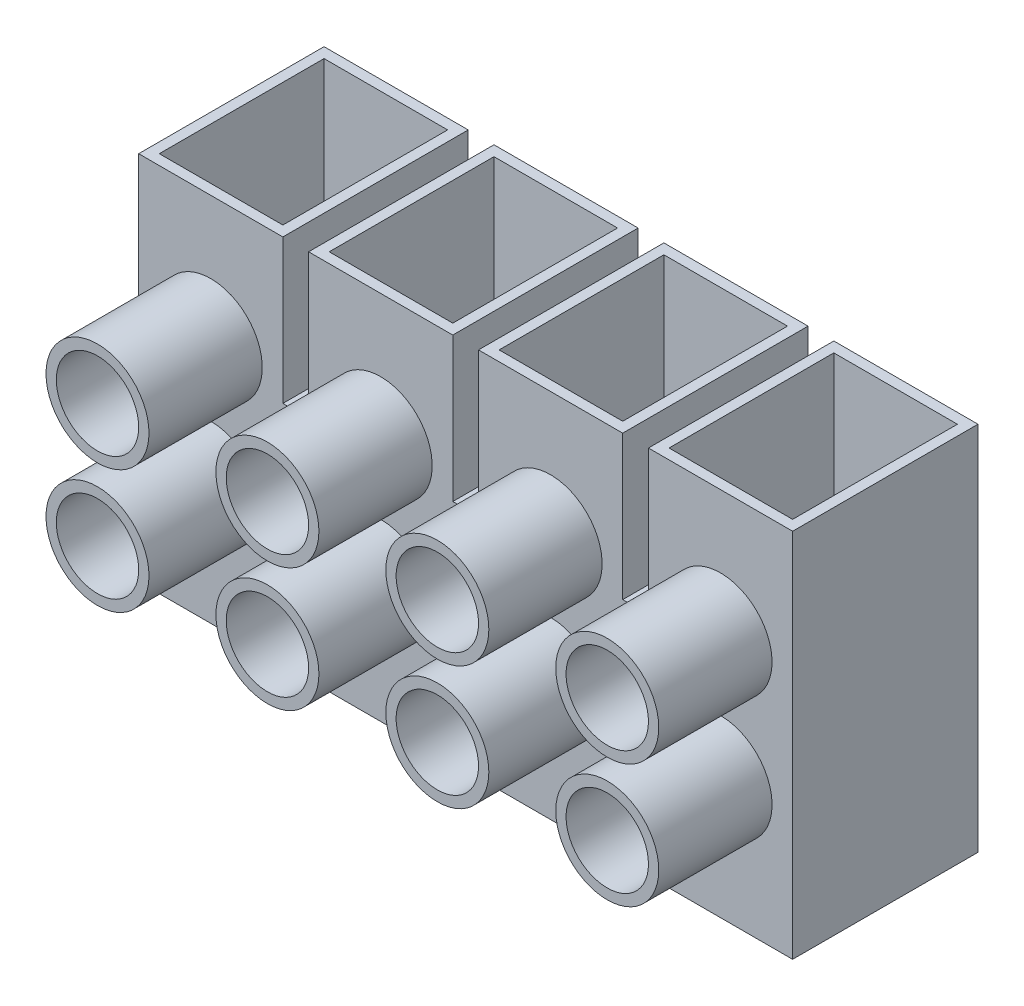
from build123d import *

# Parameters (mm, degrees)
CROQUIS1_W                = 7
CROQUIS1_H                = 18
SALIENTE_EXTRUIR1_DEPTH   = 9
SALIENTE_EXTRUIR1_2_DEPTH = 9
SALIENTE_EXTRUIR1_3_DEPTH = 9
SALIENTE_EXTRUIR1_4_DEPTH = 9
CROQUIS2_W                = 24.75
CROQUIS2_H                = 4
SALIENTE_EXTRUIR2_DEPTH   = 9
CROQUIS3_R                = 2.5
CROQUIS3_R_2              = 2
SALIENTE_EXTRUIR3_DEPTH   = 5.5
CROQUIS4_R                = 1
CORTAR_EXTRUIR1_DEPTH     = 38.59072359
CROQUIS5_W                = 6
CROQUIS5_H                = 8
CORTAR_EXTRUIR2_DEPTH     = 40.272286666


with BuildPart() as part:
    # Croquis1 → Saliente-Extruir1 (new body)
    with BuildSketch(Plane.XY):
        with Locations((11.75, 9)):
            Rectangle(CROQUIS1_W, CROQUIS1_H)
    extrude(amount=SALIENTE_EXTRUIR1_DEPTH)



with BuildPart() as body_2:
    # Croquis1 → Saliente-Extruir1 2 (new body)
    with BuildSketch(Plane.XY):
        with Locations((3.5, 9)):
            Rectangle(CROQUIS1_W, CROQUIS1_H)
    extrude(amount=SALIENTE_EXTRUIR1_2_DEPTH)


with BuildPart() as body_3:
    # Croquis1 → Saliente-Extruir1 3 (new body)
    with BuildSketch(Plane.XY):
        with Locations((20, 9)):
            Rectangle(CROQUIS1_W, CROQUIS1_H)
    extrude(amount=SALIENTE_EXTRUIR1_3_DEPTH)


with BuildPart() as body_4:
    # Croquis1 → Saliente-Extruir1 4 (new body)
    with BuildSketch(Plane.XY):
        with Locations((28.25, 9)):
            Rectangle(CROQUIS1_W, CROQUIS1_H)
    extrude(amount=SALIENTE_EXTRUIR1_4_DEPTH)


with BuildPart() as part_1:
    add(part.part)

    add(body_2.part)  # Saliente-Extruir2 merges body 2

    add(body_3.part)  # Saliente-Extruir2 merges body 3

    add(body_4.part)  # Saliente-Extruir2 merges body 4
    # Croquis2 → Saliente-Extruir2 (add)
    with BuildSketch(Plane.XY):
        with Locations((12.375, 9)):
            Rectangle(CROQUIS2_W, CROQUIS2_H)
    extrude(amount=SALIENTE_EXTRUIR2_DEPTH)

    # Croquis3 → Saliente-Extruir3 (add)
    # profile 1 of 8: a face of its own
    with BuildSketch(Plane.XY.offset(9)):
        with Locations(Location((3.5, 12, 0), (0, 0, 180))):
            Circle(CROQUIS3_R)
        with Locations((3.5, 12)):
            Circle(CROQUIS3_R_2, mode=Mode.SUBTRACT)
    # profile 2 of 8: a face of its own
    with BuildSketch(Plane.XY.offset(9)):
        with Locations(Location((11.75, 12, 0), (0, 0, 180))):
            Circle(CROQUIS3_R)
        with Locations((11.75, 12)):
            Circle(CROQUIS3_R_2, mode=Mode.SUBTRACT)
    # profile 3 of 8: a face of its own
    with BuildSketch(Plane.XY.offset(9)):
        with Locations(Location((20, 12, 0), (0, 0, 180))):
            Circle(CROQUIS3_R)
        with Locations((20, 12)):
            Circle(CROQUIS3_R_2, mode=Mode.SUBTRACT)
    # profile 4 of 8: a face of its own
    with BuildSketch(Plane.XY.offset(9)):
        with Locations(Location((28.25, 12, 0), (0, 0, 180))):
            Circle(CROQUIS3_R)
        with Locations((28.25, 12)):
            Circle(CROQUIS3_R_2, mode=Mode.SUBTRACT)
    # profile 5 of 8: a face of its own
    with BuildSketch(Plane.XY.offset(9)):
        with Locations(Location((11.75, 6, 0), (0, 0, 180))):
            Circle(CROQUIS3_R)
        with Locations((11.75, 6)):
            Circle(CROQUIS3_R_2, mode=Mode.SUBTRACT)
    # profile 6 of 8: a face of its own
    with BuildSketch(Plane.XY.offset(9)):
        with Locations(Location((20, 6, 0), (0, 0, 180))):
            Circle(CROQUIS3_R)
        with Locations((20, 6)):
            Circle(CROQUIS3_R_2, mode=Mode.SUBTRACT)
    # profile 7 of 8: a face of its own
    with BuildSketch(Plane.XY.offset(9)):
        with Locations(Location((28.25, 6, 0), (0, 0, 180))):
            Circle(CROQUIS3_R)
        with Locations((28.25, 6)):
            Circle(CROQUIS3_R_2, mode=Mode.SUBTRACT)
    # profile 8 of 8: a face of its own
    with BuildSketch(Plane.XY.offset(9)):
        with Locations(Location((3.5, 6, 0), (0, 0, 180))):
            Circle(CROQUIS3_R)
        with Locations((3.5, 6)):
            Circle(CROQUIS3_R_2, mode=Mode.SUBTRACT)
    extrude(amount=SALIENTE_EXTRUIR3_DEPTH)

    # Croquis4 → Cortar-Extruir1 (cut, through all)
    with BuildSketch(Plane.XY.offset(9)):
        with Locations((7.625, 9)):
            Circle(CROQUIS4_R)
        with Locations((15.875, 9)):
            Circle(CROQUIS4_R)
        with Locations((24.125, 9)):
            Circle(CROQUIS4_R)
    extrude(amount=-CORTAR_EXTRUIR1_DEPTH, mode=Mode.SUBTRACT)

    # Croquis5 → Cortar-Extruir2 (cut, through all)
    with BuildSketch(Plane.XZ):
        with Locations((3.5, 4.5)):
            Rectangle(CROQUIS5_W, CROQUIS5_H)
        with Locations((11.75, 4.5)):
            Rectangle(CROQUIS5_W, CROQUIS5_H)
        with Locations((20, 4.5)):
            Rectangle(CROQUIS5_W, CROQUIS5_H)
        with Locations((28.25, 4.5)):
            Rectangle(CROQUIS5_W, CROQUIS5_H)
    extrude(amount=-CORTAR_EXTRUIR2_DEPTH, mode=Mode.SUBTRACT)


solid = part_1.part
